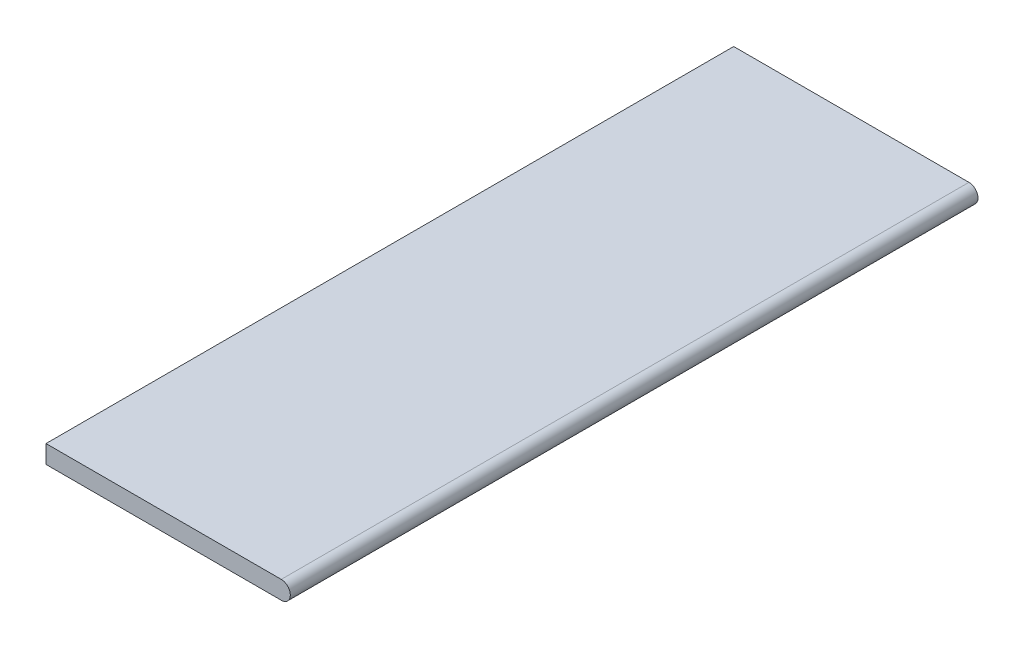
from build123d import *

# Parameters (mm, degrees)
SKETCH_1_W           = 65
SKETCH_1_H           = 190
EXTRUDE_1_DEPTH      = 5
EXTRUDE_2_DEPTH      = 95
EXTRUDE_2_DEPTH_BACK = 95


with BuildPart() as part:
    # Эскиз1 → Бобышка-Вытянуть1 (new body)
    with BuildSketch(Plane(origin=(0, 0, 0), x_dir=(1, 0, 0), z_dir=(0, 1, 0))):
        Rectangle(SKETCH_1_W, SKETCH_1_H)
    extrude(amount=EXTRUDE_1_DEPTH)

    # Эскиз2 → Бобышка-Вытянуть2 (add, two sides: drawn at the far end of the back side and taken through both)
    with BuildSketch(Plane.XY.offset(-EXTRUDE_2_DEPTH_BACK)):
        with BuildLine():
            ThreePointArc((32.5, 5), (35, 2.5), (32.5, 0))
            Line((32.5, 0), (32.5, 5))
        make_face()
    extrude(amount=EXTRUDE_2_DEPTH + EXTRUDE_2_DEPTH_BACK)


solid = part.part
